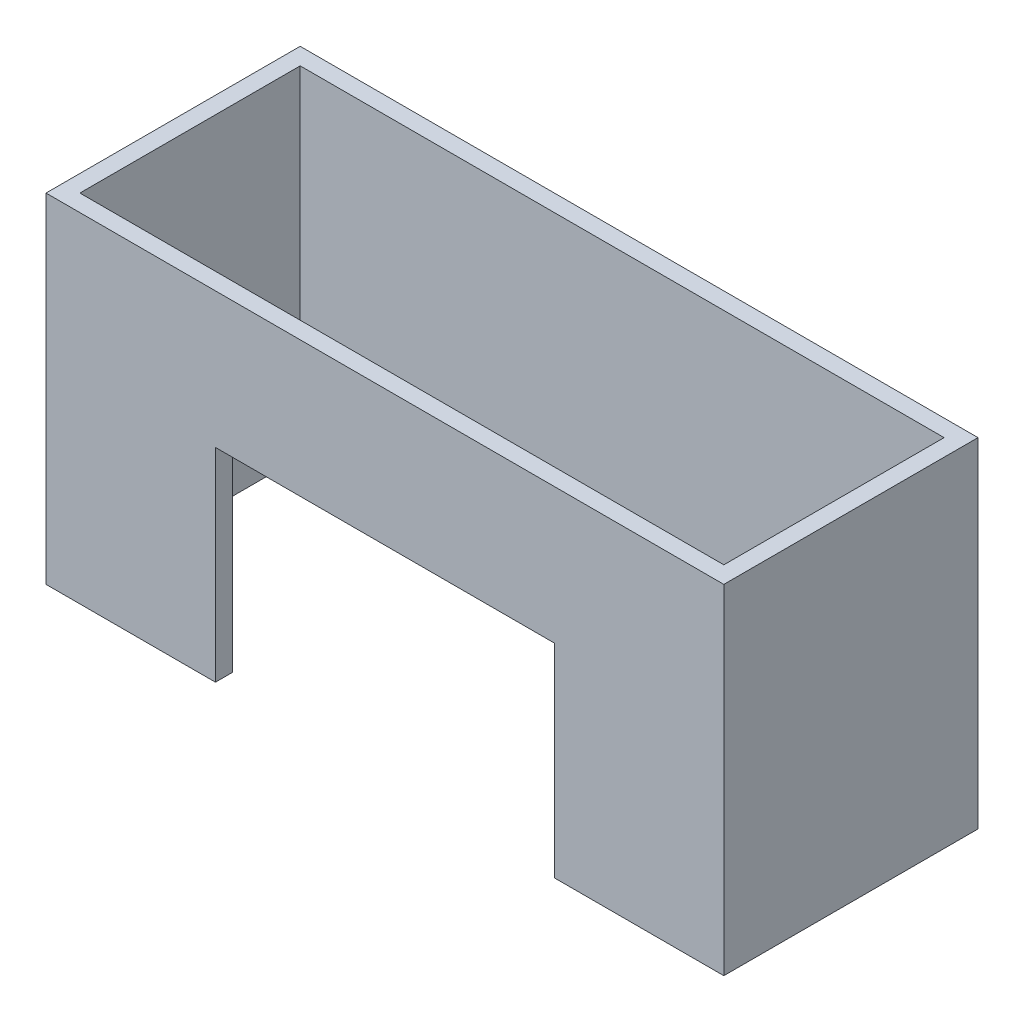
from build123d import *

# Parameters (mm, degrees)
SKETCH1_W           = 400
SKETCH1_H           = 200
BOSS_EXTRUDE1_DEPTH = 150
SKETCH2_W           = 200
SKETCH2_H           = 120
CUT_EXTRUDE1_DEPTH  = 20
SKETCH3_W           = 380
SKETCH3_H           = 130
CUT_EXTRUDE2_DEPTH  = 200


with BuildPart() as part:
    # Sketch1 → Boss-Extrude1 (new body)
    with BuildSketch(Plane.XY):
        with Locations((-200, 100)):
            Rectangle(SKETCH1_W, SKETCH1_H)
    extrude(amount=BOSS_EXTRUDE1_DEPTH)

    # Sketch2 → Cut-Extrude1 (cut)
    with BuildSketch(Plane.XY.offset(150)):
        with Locations((-200, 60)):
            Rectangle(SKETCH2_W, SKETCH2_H)
    extrude(amount=-CUT_EXTRUDE1_DEPTH, mode=Mode.SUBTRACT)

    # Sketch3 → Cut-Extrude2 (cut)
    with BuildSketch(Plane(origin=(0, 200, 0), x_dir=(1, 0, 0), z_dir=(0, 1, 0))):
        with Locations((-200, -75)):
            Rectangle(SKETCH3_W, SKETCH3_H)
    extrude(amount=-CUT_EXTRUDE2_DEPTH, mode=Mode.SUBTRACT)


solid = part.part
